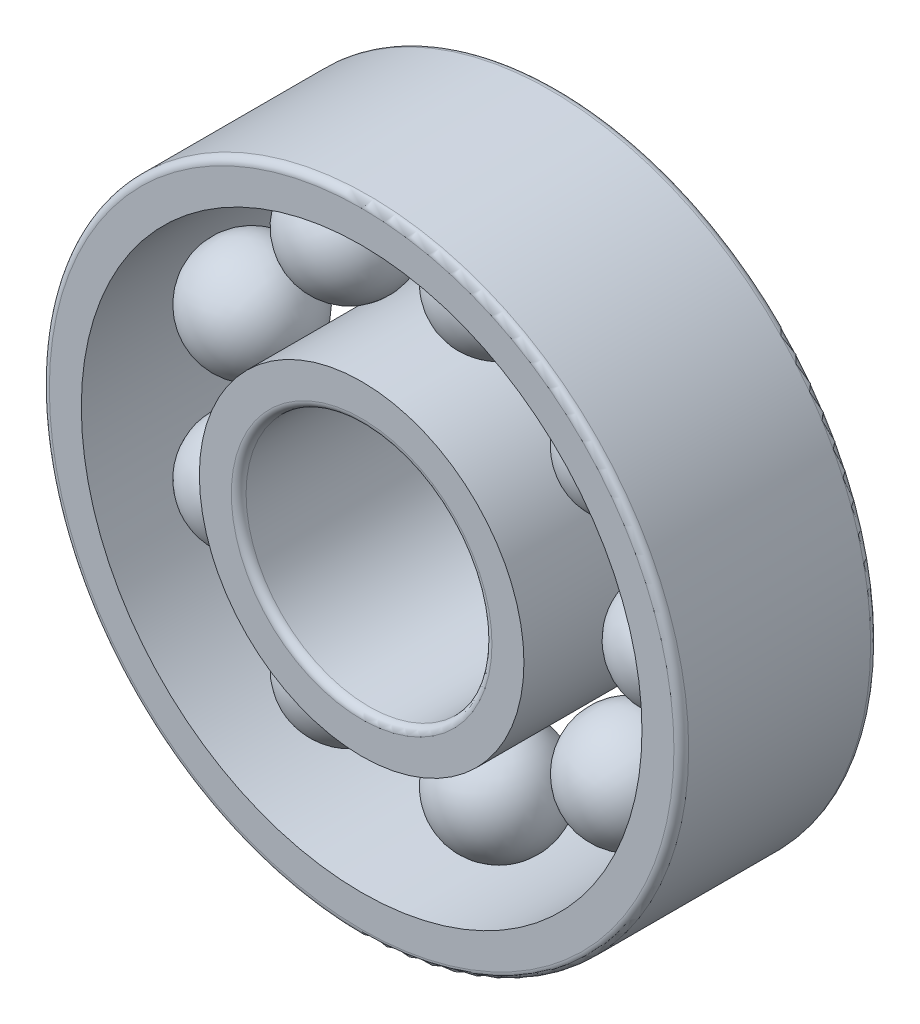
from build123d import *

# Parameters (mm, degrees)
INNERS_W           = 1.6
INNERS_H           = 8
OUTERS_W           = 1.6
OUTERS_H           = 8
BALLSPATTERN_COUNT = 9
FILLET_F1_R        = 0.3
FILLET_F2_R        = 0.3


with BuildPart() as part:
    # InnerS → InnerRing (revolve)
    with BuildSketch(Plane(origin=(0, 0, 0), x_dir=(1, 0, 0), z_dir=(0, 1, 0))):
        with Locations((5.8, 0)):
            Rectangle(INNERS_W, INNERS_H)
    revolve(axis=Axis((0, 0, 7), (0, 0, -1)))

    # Fillet F2
    fillet_f2_edges = [part.edges().sort_by_distance(p)[0] for p in [
        (-5, 0, -4),
        (-5, 0, 4),
    ]]
    fillet(fillet_f2_edges, radius=FILLET_F2_R)


with BuildPart() as body_2:
    # OuterS → OuterRing (revolve)
    with BuildSketch(Plane(origin=(0, 0, 0), x_dir=(1, 0, 0), z_dir=(0, 1, 0))):
        with Locations((12.2, 0)):
            Rectangle(OUTERS_W, OUTERS_H)
    revolve(axis=Axis((0, 0, 7), (0, 0, -1)))

    # Fillet F1
    fillet_f1_edges = [body_2.edges().sort_by_distance(p)[0] for p in [
        (-13, 0, -4),
        (-13, 0, 4),
    ]]
    fillet(fillet_f1_edges, radius=FILLET_F1_R)


with BuildPart() as body_3:
    # BallS → Ball (revolve)
    with BuildSketch(Plane(origin=(0, 0, 0), x_dir=(1, 0, 0), z_dir=(0, 1, 0))):
        with BuildLine():
            Line((6.72, 0), (11.28, 0))
            ThreePointArc((11.28, 0), (9, -2.28), (6.72, 0))
        make_face()
    revolve(axis=Axis((6.72, 0, 0), (1, 0, 0)))


with BuildPart() as ballspattern_1:
    # BallsPattern: pattern copy
    add(body_3.part.rotate(Axis((0, 0, -4.4), (0, 0, 1)), 1 * 360 / BALLSPATTERN_COUNT))


with BuildPart() as ballspattern_2:
    # BallsPattern: pattern copy
    add(body_3.part.rotate(Axis((0, 0, -4.4), (0, 0, 1)), 2 * 360 / BALLSPATTERN_COUNT))


with BuildPart() as ballspattern_3:
    # BallsPattern: pattern copy
    add(body_3.part.rotate(Axis((0, 0, -4.4), (0, 0, 1)), 3 * 360 / BALLSPATTERN_COUNT))


with BuildPart() as ballspattern_4:
    # BallsPattern: pattern copy
    add(body_3.part.rotate(Axis((0, 0, -4.4), (0, 0, 1)), 4 * 360 / BALLSPATTERN_COUNT))


with BuildPart() as ballspattern_5:
    # BallsPattern: pattern copy
    add(body_3.part.rotate(Axis((0, 0, -4.4), (0, 0, 1)), 5 * 360 / BALLSPATTERN_COUNT))


with BuildPart() as ballspattern_6:
    # BallsPattern: pattern copy
    add(body_3.part.rotate(Axis((0, 0, -4.4), (0, 0, 1)), 6 * 360 / BALLSPATTERN_COUNT))


with BuildPart() as ballspattern_7:
    # BallsPattern: pattern copy
    add(body_3.part.rotate(Axis((0, 0, -4.4), (0, 0, 1)), 7 * 360 / BALLSPATTERN_COUNT))


with BuildPart() as ballspattern_8:
    # BallsPattern: pattern copy
    add(body_3.part.rotate(Axis((0, 0, -4.4), (0, 0, 1)), 8 * 360 / BALLSPATTERN_COUNT))


solid = Compound([part.part, body_2.part, body_3.part, ballspattern_1.part, ballspattern_2.part, ballspattern_3.part, ballspattern_4.part, ballspattern_5.part, ballspattern_6.part, ballspattern_7.part, ballspattern_8.part])
